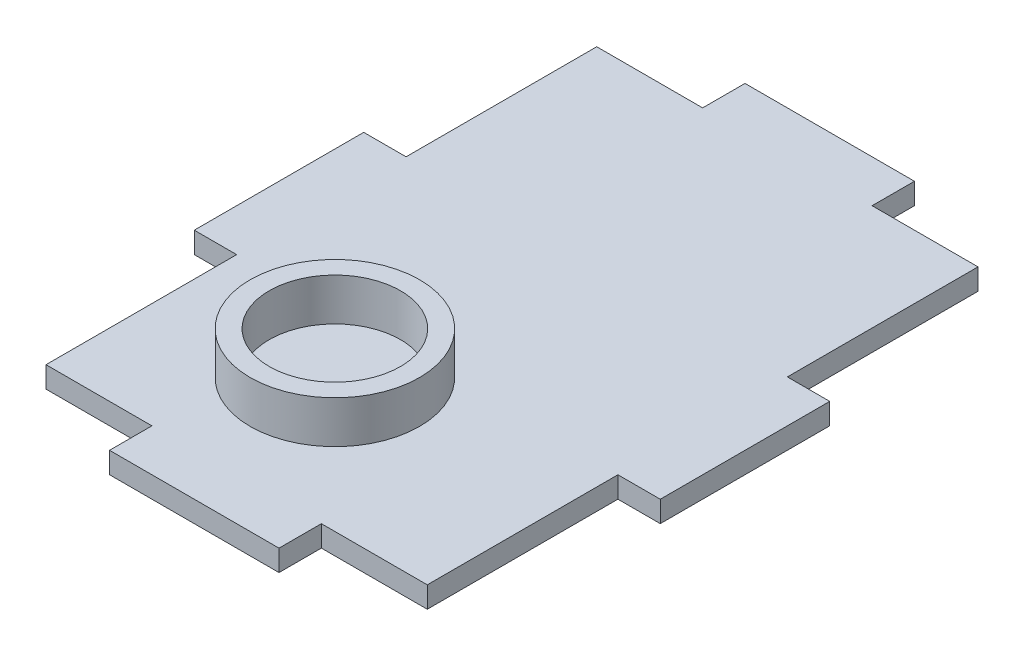
from build123d import *

# Parameters (mm, degrees)
SKETCH1_W           = 90
SKETCH1_H           = 130
SKETCH1_W_2         = 10
SKETCH1_H_2         = 40
SKETCH1_W_3         = 40
SKETCH1_H_3         = 10
BOSS_EXTRUDE1_DEPTH = 5
SKETCH4_R           = 20
SKETCH4_R_2         = 15.5
BOSS_EXTRUDE2_DEPTH = 10


with BuildPart() as part:
    # Sketch1 → Boss-Extrude1 (new body)
    with BuildSketch(Plane(origin=(0, 0, 0), x_dir=(1, 0, 0), z_dir=(0, 1, 0))):
        with Locations((45, 65)):
            Rectangle(SKETCH1_W, SKETCH1_H)
        with Locations((-5, 65)):
            Rectangle(SKETCH1_W_2, SKETCH1_H_2)
        with Locations((95, 65)):
            Rectangle(SKETCH1_W_2, SKETCH1_H_2)
        with Locations((45, -5)):
            Rectangle(SKETCH1_W_3, SKETCH1_H_3)
        with Locations((45, 135)):
            Rectangle(SKETCH1_W_3, SKETCH1_H_3)
    extrude(amount=BOSS_EXTRUDE1_DEPTH)

    # Sketch4 → Boss-Extrude2 (add)
    with BuildSketch(Plane(origin=(0, 5, 0), x_dir=(1, 0, 0), z_dir=(0, 1, 0))):
        with Locations(Location((36.72, 31.47, 0), (0, 0, 270))):
            Circle(SKETCH4_R)
        with Locations(Location((36.72, 31.47, 0), (0, 0, 270))):
            Circle(SKETCH4_R_2, mode=Mode.SUBTRACT)
    extrude(amount=BOSS_EXTRUDE2_DEPTH)


solid = part.part
